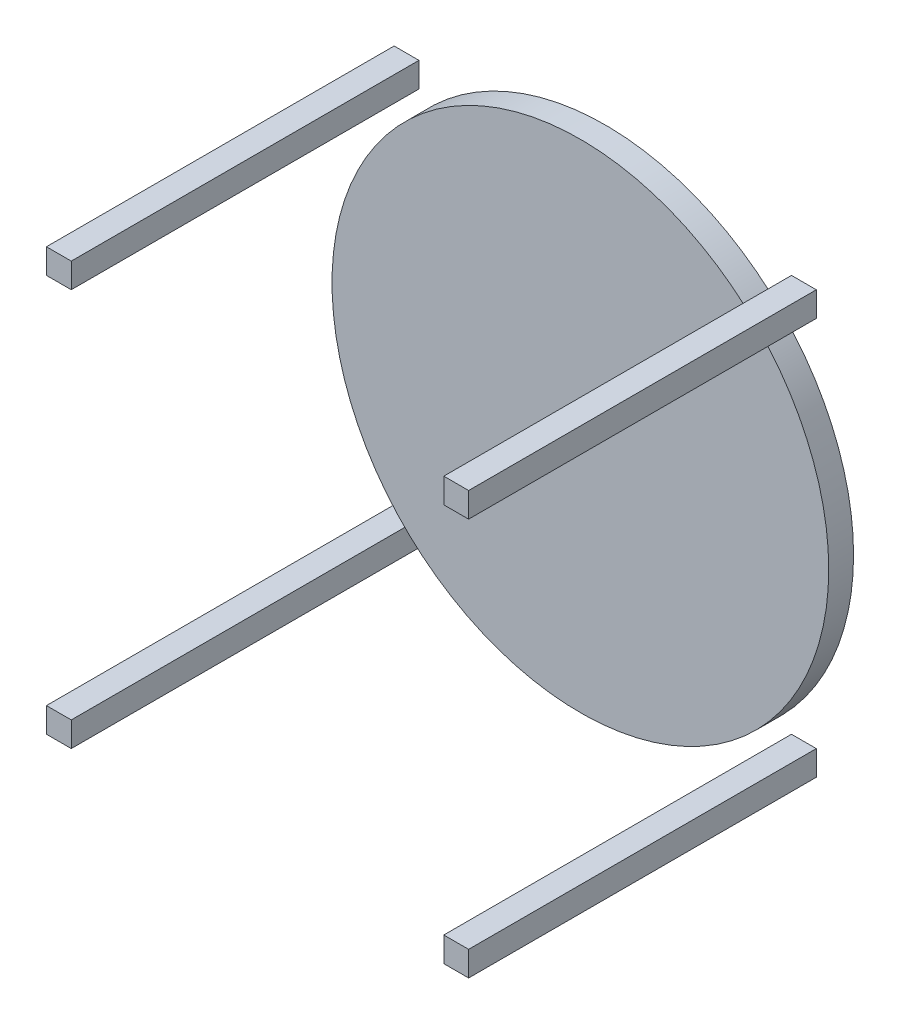
from build123d import *

# Parameters (mm, degrees)
SKETCH_1_R          = 500
EXTRUDE_1_DEPTH     = 50
SKETCH_2_W          = 50
SKETCH_2_H          = 50
EXTRUDE_2_DEPTH     = 700
SKETCH_3_W          = 50
SKETCH_3_H          = 50
EXTRUDE_3_DEPTH     = 700
SKETCH_4_W          = 50
SKETCH_4_H          = 50
EXTRUDE_4_DEPTH     = 700
SKETCH_5_W          = 50
SKETCH_5_H          = 50
EXTRUDE_5_DEPTH     = 700
SKETCH_6_R          = 200
CUT_EXTRUDE_1_DEPTH = 20


with BuildPart() as part:
    # 草图1 → 凸台-拉伸1 (new body)
    with BuildSketch(Plane.XY):
        Circle(SKETCH_1_R)
    extrude(amount=EXTRUDE_1_DEPTH)

    # 草图6 → 切除-拉伸1 (cut)
    with BuildSketch(Plane.XY):
        Circle(SKETCH_6_R)
    extrude(amount=CUT_EXTRUDE_1_DEPTH, mode=Mode.SUBTRACT)


with BuildPart() as body_2:
    # 草图2 → 凸台-拉伸2 (new body)
    with BuildSketch(Plane.XY):
        with Locations((400, 400)):
            Rectangle(SKETCH_2_W, SKETCH_2_H)
    extrude(amount=EXTRUDE_2_DEPTH)


with BuildPart() as body_3:
    # 草图3 → 凸台-拉伸3 (new body)
    with BuildSketch(Plane.XY):
        with Locations((-400, 400)):
            Rectangle(SKETCH_3_W, SKETCH_3_H)
    extrude(amount=EXTRUDE_3_DEPTH)


with BuildPart() as body_4:
    # 草图4 → 凸台-拉伸4 (new body)
    with BuildSketch(Plane.XY):
        with Locations((400, -400)):
            Rectangle(SKETCH_4_W, SKETCH_4_H)
    extrude(amount=EXTRUDE_4_DEPTH)


with BuildPart() as body_5:
    # 草图5 → 凸台-拉伸5 (new body)
    with BuildSketch(Plane.XY):
        with Locations((-400, -400)):
            Rectangle(SKETCH_5_W, SKETCH_5_H)
    extrude(amount=EXTRUDE_5_DEPTH)


solid = Compound([part.part, body_2.part, body_3.part, body_4.part, body_5.part])
